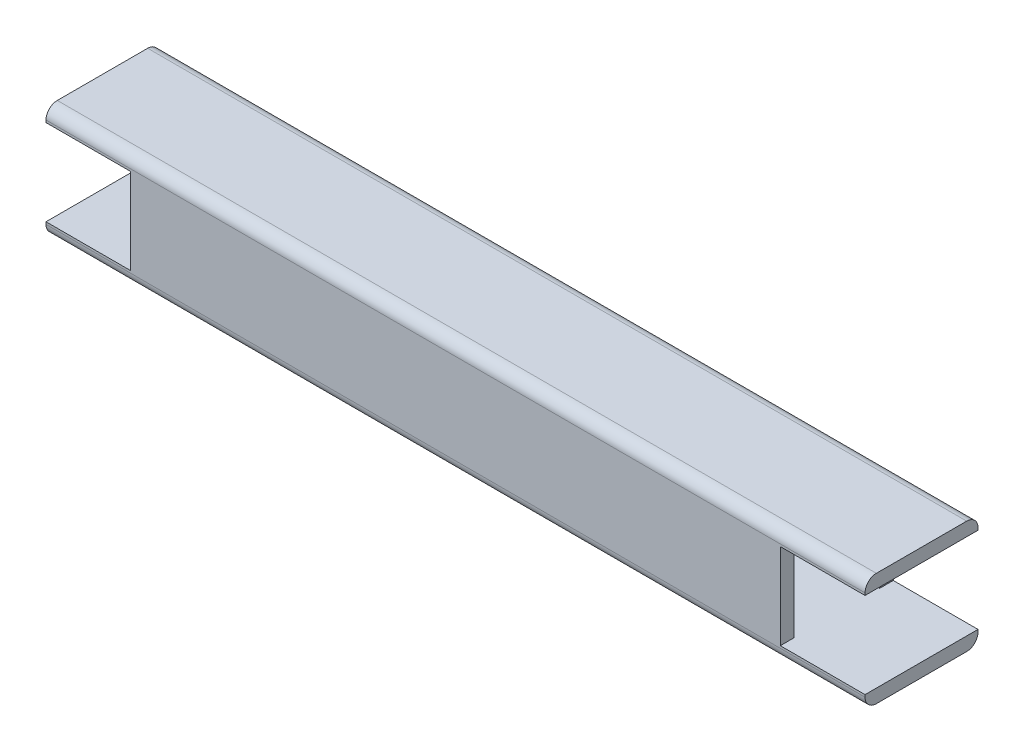
from build123d import *

# Parameters (mm, degrees)
SKETCH1_W           = 19.304
SKETCH1_H           = 19.304
BOSS_EXTRUDE1_DEPTH = 184.15
SKETCH2_W           = 25.4
SKETCH2_H           = 19.304
CUT_EXTRUDE1_DEPTH  = 19.05
SKETCH3_W           = 25.4
SKETCH3_H           = 19.304
CUT_EXTRUDE2_DEPTH  = 19.05


with BuildPart() as part:
    # Sketch1 → Boss-Extrude1 (new body)
    with BuildSketch(Plane(origin=(0, 0, 0), x_dir=(0, 0, -1), z_dir=(1, 0, 0))):
        with BuildLine():
            Line((0, 2.54), (0, 22.86))
            ThreePointArc((0, 22.86), (-0.743948776, 24.656051224), (-2.54, 25.4))
            Line((-2.54, 25.4), (-22.86, 25.4))
            ThreePointArc((-22.86, 25.4), (-24.656051224, 24.656051224), (-25.4, 22.86))
            Line((-25.4, 22.86), (-25.4, 2.54))
            ThreePointArc((-25.4, 2.54), (-24.656051224, 0.743948776), (-22.86, 0))
            Line((-22.86, 0), (-2.54, 0))
            ThreePointArc((-2.54, 0), (-0.743948776, 0.743948776), (0, 2.54))
        make_face()
        with Locations((-12.7, 12.7)):
            Rectangle(SKETCH1_W, SKETCH1_H, mode=Mode.SUBTRACT)
    extrude(amount=BOSS_EXTRUDE1_DEPTH)

    # Sketch2 → Cut-Extrude1 (cut)
    with BuildSketch(Plane(origin=(184.15, 0, 0), x_dir=(0, 0, -1), z_dir=(1, 0, 0))):
        with Locations((-12.7, 12.7)):
            Rectangle(SKETCH2_W, SKETCH2_H)
    extrude(amount=-CUT_EXTRUDE1_DEPTH, mode=Mode.SUBTRACT)

    # Sketch3 → Cut-Extrude2 (cut)
    with BuildSketch(Plane.ZY):
        with Locations((12.7, 12.7)):
            Rectangle(SKETCH3_W, SKETCH3_H)
    extrude(amount=-CUT_EXTRUDE2_DEPTH, mode=Mode.SUBTRACT)


solid = part.part
